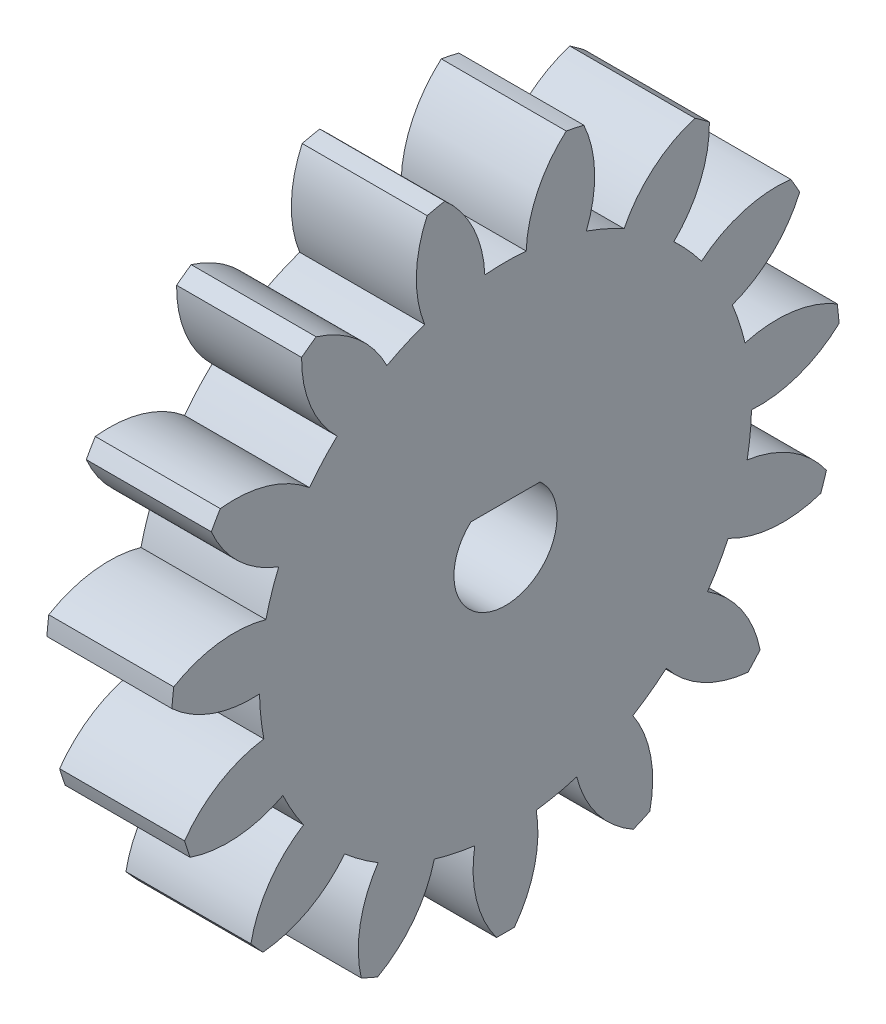
from build123d import *

# Parameters (mm, degrees)
BASPROSKE_W        = 6.35
BASPROSKE_H        = 17
TOOTHCUT_DEPTH     = 25.86609137
TEETHCUTS_COUNT    = 15
BORSKE_R           = 0.4
BORE_DEPTH         = 50.0000508
CUT_EXTRUDE1_REACH = 26.831


with BuildPart() as part:
    # BasProSke → Base-Revolve (revolve)
    with BuildSketch(Plane(origin=(0, 0, 0), x_dir=(1, 0, 0), z_dir=(0, 1, 0)), mode=Mode.PRIVATE) as base_revolve_sk:
        with Locations((3.175, 8.5)):
            Rectangle(BASPROSKE_W, BASPROSKE_H)
    revolve(base_revolve_sk.sketch.rotate(Axis((-10, 0, 0), (1, 0, 0)), 180), axis=Axis((-10, 0, 0), (1, 0, 0)))

    # TooCutSke → ToothCut (cut, through all)
    with BuildSketch(Plane(origin=(0, 0, 0), x_dir=(0, 0, -1), z_dir=(1, 0, 0))):
        with BuildLine():
            ThreePointArc((1.050056448, 12.454813626), (0, 12.499), (-1.050056448, 12.454813626))
            ThreePointArc((-1.050056448, 12.454813626), (-1.638118106, 14.809604533), (-3.110934279, 16.73876737))
            ThreePointArc((-3.110934279, 16.73876737), (0, 17.0254), (3.110934279, 16.73876737))
            ThreePointArc((3.110934279, 16.73876737), (1.638118106, 14.809604533), (1.050056448, 12.454813626))
        make_face()
    toothcut = extrude(amount=TOOTHCUT_DEPTH, mode=Mode.SUBTRACT)

    # TeethCuts: ToothCut ×15 about axis
    teethcuts_axis = Axis((0, 0, 0), (1, 0, 0))
    for i in range(1, TEETHCUTS_COUNT):
        add(toothcut.rotate(teethcuts_axis, i * 360 / TEETHCUTS_COUNT), mode=Mode.SUBTRACT)

    # BorSke → Bore (cut, symmetric)
    with BuildSketch(Plane(origin=(0, 0, 0), x_dir=(0, 0, -1), z_dir=(1, 0, 0))):
        with Locations(Location((0, 0, 0), (0, 0, 180))):
            Circle(BORSKE_R)
    extrude(amount=BORE_DEPTH, both=True, mode=Mode.SUBTRACT)

    # Sketch1 → Cut-Extrude1 (cut, up to next)
    with BuildSketch(Plane.ZY, mode=Mode.PRIVATE) as cut_extrude1_sk1:
        with BuildLine():
            Line((1.659895813, 1.69164), (-1.659895813, 1.69164))
            ThreePointArc((-1.659895813, 1.69164), (-0.917318626, -2.185274934), (2.37, 0))
            ThreePointArc((2.37, 0), (2.185274934, 0.917318626), (1.659895813, 1.69164))
        make_face()
    cut_extrude1_tool1 = extrude(cut_extrude1_sk1.sketch, amount=-CUT_EXTRUDE1_REACH, mode=Mode.PRIVATE) & part.part
    # Sketch1 → Cut-Extrude1 (cut, up to next)
    with BuildSketch(Plane.ZY, mode=Mode.PRIVATE) as cut_extrude1_sk2:
        with BuildLine():
            ThreePointArc((-1.75910037, 1.94164), (0, -2.62), (1.75910037, 1.94164))
            Line((1.75910037, 1.94164), (-1.75910037, 1.94164))
        make_face()
    cut_extrude1_tool2 = extrude(cut_extrude1_sk2.sketch, amount=-CUT_EXTRUDE1_REACH, mode=Mode.PRIVATE) & part.part
    add(cut_extrude1_tool1.solids().sort_by_distance((0, -0.189427, 0))[0], mode=Mode.SUBTRACT)
    add(cut_extrude1_tool2.solids().sort_by_distance((0, -0.182106, 0))[0], mode=Mode.SUBTRACT)


solid = part.part
